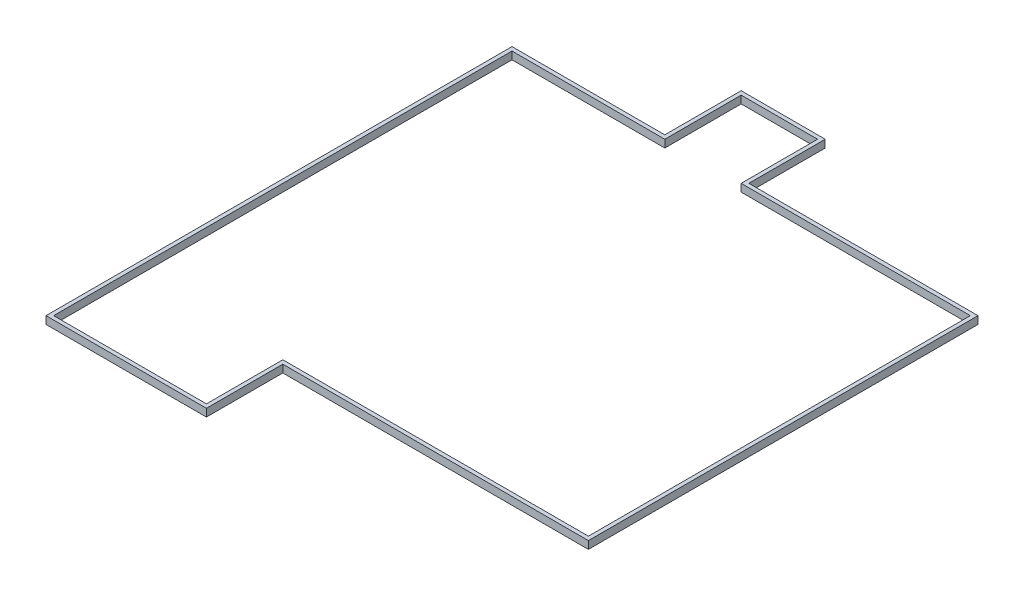
from build123d import *

# Parameters (mm, degrees)
EXTRUDE_1_DEPTH = 80


with BuildPart() as part:
    # 草图4 → 凸台-拉伸1 (new body)
    with BuildSketch(Plane(origin=(0, 0, 0), x_dir=(1, 0, 0), z_dir=(0, 1, 0))):
        Polygon((-840, 2840), (-2440, 2840), (-2440, -2040), (-760, -2040), (-760, -1240), (2440, -1240), (2440, 2840), (40, 2840), (40, 3640), (-840, 3640), align=None)
        Polygon((-800, 2800), (-2400, 2800), (-2400, -2000), (-800, -2000), (-800, -1200), (2400, -1200), (2400, 2800), (0, 2800), (0, 3600), (-800, 3600), align=None, mode=Mode.SUBTRACT)
    extrude(amount=EXTRUDE_1_DEPTH)


solid = part.part
